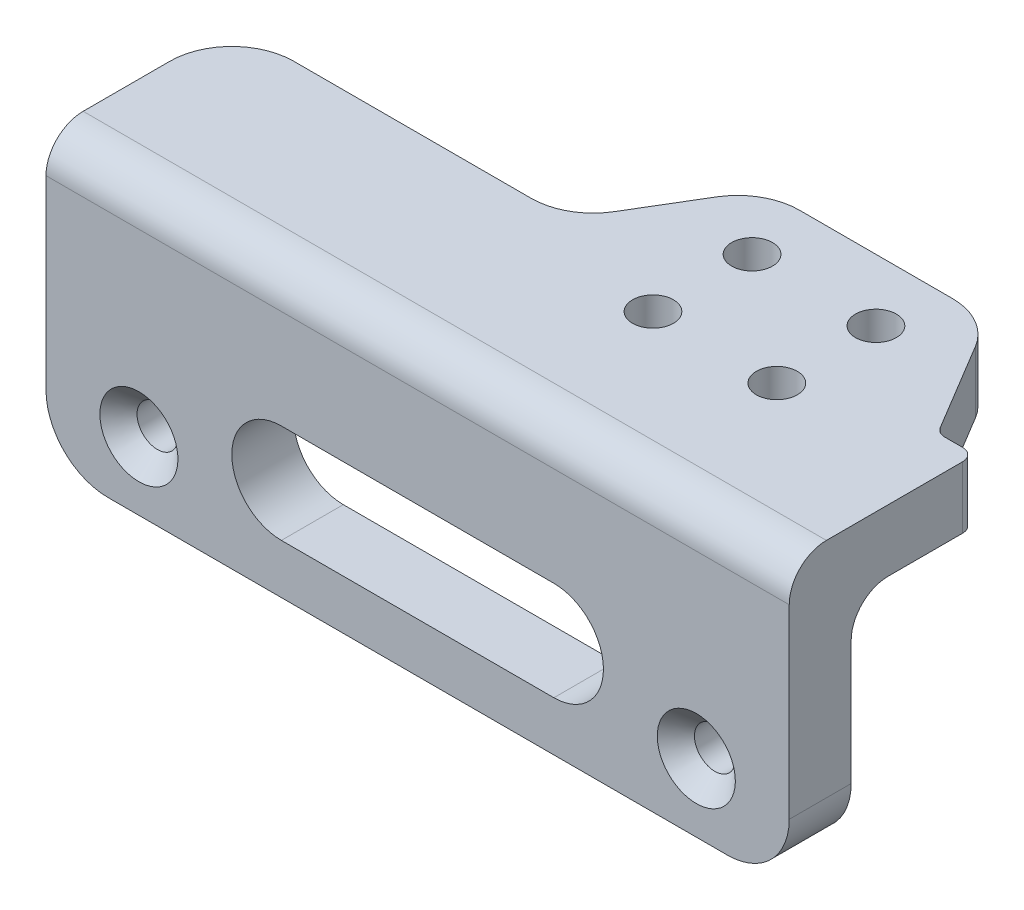
from build123d import *

# Parameters (mm, degrees)
BOSS_EXTRUDE1_DEPTH     = 30
CUT_EXTRUDE1_DEPTH      = 41.298883359
CUT_EXTRUDE1_DEPTH_BACK = 41.298883359
SKETCH2_R               = 1.65
CUT_EXTRUDE2_DEPTH      = 41.298883359
CUT_EXTRUDE2_DEPTH_BACK = 41.298883359
SKETCH3_R               = 1.65
FILLET1_R               = 5
FILLET2_R               = 3
CHAMFER1_SIZE           = 2
CHAMFER2_SIZE           = 1.5
CUT_EXTRUDE3_DEPTH      = 44
CUT_EXTRUDE3_DEPTH_BACK = 44
FILLET3_R               = 1


with BuildPart() as part:
    # Sketch1 → Boss-Extrude1 (new, symmetric)
    with BuildSketch(Plane(origin=(0, 0, 0), x_dir=(0, 0, -1), z_dir=(1, 0, 0))):
        Polygon((0, 0), (20, 0), (20, 5), (-5, 5), (-5, -18), (0, -18), align=None)
    extrude(amount=BOSS_EXTRUDE1_DEPTH, both=True)

    # Sketch2 → Cut-Extrude1 (cut, two sides: drawn at the far end of the back side and taken through both)
    with BuildSketch(Plane.XY.offset(-CUT_EXTRUDE1_DEPTH_BACK)):
        with Locations((22.5, -12.5)):
            Circle(SKETCH2_R)
        with Locations(Location((-22.5, -12.5, 0), (0, 0, 270))):
            Circle(SKETCH2_R)
    extrude(amount=CUT_EXTRUDE1_DEPTH + CUT_EXTRUDE1_DEPTH_BACK, mode=Mode.SUBTRACT)

    # Sketch3 → Cut-Extrude2 (cut, two sides: drawn at the far end of the back side and taken through both)
    with BuildSketch(Plane(origin=(0, 0, 0), x_dir=(1, 0, 0), z_dir=(0, 1, 0)).offset(-CUT_EXTRUDE2_DEPTH_BACK)):
        with Locations(Location((7, 7, 0), (0, 0, 270))):
            Circle(SKETCH3_R)
        with Locations(Location((17, 7, 0), (0, 0, 270))):
            Circle(SKETCH3_R)
        with Locations(Location((17, 15, 0), (0, 0, 270))):
            Circle(SKETCH3_R)
        with Locations(Location((7, 15, 0), (0, 0, 270))):
            Circle(SKETCH3_R)
        Polygon((21, 20), (27, 10), (30, 10), (38.233411058, 24.132528873), (36.351497345, 35.273458054), (14.220192082, 36.929542121), (-3.211887252, 31.82230336), (-34.48112888, 29.547116003), (-37.048006924, 19.046251277), (-30, 10), (-3, 10), (3, 20), align=None)
    extrude(amount=CUT_EXTRUDE2_DEPTH + CUT_EXTRUDE2_DEPTH_BACK, mode=Mode.SUBTRACT)

    # Fillet1
    fillet1_edges = [part.edges().sort_by_distance(p)[0] for p in [
        (30, -18, 2.5),
        (-30, 2.5, -10),
        (21, 2.5, -20),
        (3, 2.5, -20),
        (-3, 2.5, -10),
        (-30, -18, 2.5),
    ]]
    fillet(fillet1_edges, radius=FILLET1_R)

    # Fillet2
    fillet2_edges = [part.edges().sort_by_distance(p)[0] for p in [
        (0, 5, 5),
        (0, 0, 0),
    ]]
    fillet(fillet2_edges, radius=FILLET2_R)

    # Chamfer1
    chamfer1_edges = [part.edges().sort_by_distance(p)[0] for p in [
        (7, 0, -8.65),
        (17, 0, -16.65),
        (7, 0, -16.65),
        (17, 0, -8.65),
    ]]
    chamfer(chamfer1_edges, length=CHAMFER1_SIZE)

    # Chamfer2
    chamfer2_edges = [part.edges().sort_by_distance(p)[0] for p in [
        (20.85, -12.5, 5),
        (-22.5, -10.85, 5),
    ]]
    chamfer(chamfer2_edges, length=CHAMFER2_SIZE)

    # Sketch4 → Cut-Extrude3 (cut, two sides: drawn at the far end of the back side and taken through both)
    with BuildSketch(Plane.XY.offset(5).offset(-CUT_EXTRUDE3_DEPTH_BACK)):
        with BuildLine():
            Line((-11, -6), (11, -6))
            ThreePointArc((11, -6), (15, -10), (11, -14))
            Line((11, -14), (-11, -14))
            ThreePointArc((-11, -14), (-15, -10), (-11, -6))
        make_face()
    extrude(amount=CUT_EXTRUDE3_DEPTH + CUT_EXTRUDE3_DEPTH_BACK, mode=Mode.SUBTRACT)

    # Fillet3
    fillet3_edges = [part.edges().sort_by_distance(p)[0] for p in [
        (30, 2.5, -10),
        (27, 2.5, -10),
    ]]
    fillet(fillet3_edges, radius=FILLET3_R)


solid = part.part
